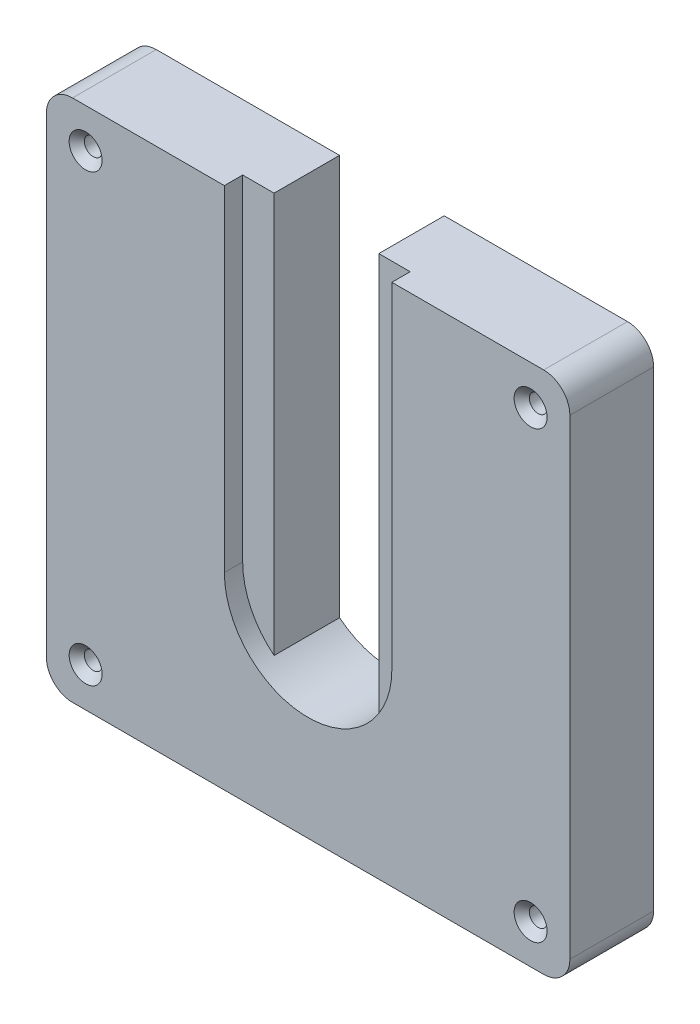
from build123d import *

# Parameters (mm, degrees)
SKETCH1_W                                    = 100
SKETCH1_H                                    = 100
BOSS_EXTRUDE1_DEPTH                          = 16
SKETCH2_W                                    = 100
SKETCH2_H                                    = 100
BOSS_EXTRUDE2_DEPTH                          = 16
CUT_EXTRUDE1_DEPTH                           = 80
BOSS_EXTRUDE3_DEPTH                          = 16
BOSS_EXTRUDE4_REACH                          = 75.763
CSK_FOR_M3_COUNTERSUNK_FLAT_HEAD_SCR_2_COUNT = 2
CSK_FOR_M3_COUNTERSUNK_FLAT_HEAD_SCR_2_PITCH = 85
CSK_FOR_M3_COUNTERSUNK_FLAT_HEAD_SCR_3_COUNT = 2
CSK_FOR_M3_COUNTERSUNK_FLAT_HEAD_SCR_3_PITCH = 120.208152802
CSK_FOR_M3_COUNTERSUNK_FLAT_HEAD_SCR_4_COUNT = 2
CSK_FOR_M3_COUNTERSUNK_FLAT_HEAD_SCR_4_PITCH = 85
FILLET1_R                                    = 5
FILLET2_R                                    = 5


with BuildPart() as part:
    # Sketch1 → Boss-Extrude1 (new body)
    with BuildSketch(Plane.XY):
        Rectangle(SKETCH1_W, SKETCH1_H)
    extrude(amount=BOSS_EXTRUDE1_DEPTH)


with BuildPart() as body_2:
    # Sketch2 → Boss-Extrude2 (new body)
    with BuildSketch(Plane.XY.offset(16)):
        Rectangle(SKETCH2_W, SKETCH2_H)
    extrude(amount=BOSS_EXTRUDE2_DEPTH)


with BuildPart() as cut_extrude1_tool:
    # Sketch3 → Cut-Extrude1 (new body)
    with BuildSketch(Plane(origin=(0, 50, 0), x_dir=(1, 0, 0), z_dir=(0, 1, 0))):
        Polygon((-16, -32), (-16, -28.5), (-10, -28.5), (-10, -16), (-16, -16), (-16, -11), (16, -11), (16, -16), (10, -16), (10, -28.5), (16, -28.5), (16, -32), align=None)
    extrude(amount=-CUT_EXTRUDE1_DEPTH)


with BuildPart() as part_1:
    add(part.part)

    # Cut-Extrude1: cut by cut_extrude1_tool
    add(cut_extrude1_tool.part, mode=Mode.SUBTRACT)



with BuildPart() as body_2_1:
    add(body_2.part)

    # Cut-Extrude1: cut by cut_extrude1_tool
    add(cut_extrude1_tool.part, mode=Mode.SUBTRACT)

    # Sketch4 → Boss-Extrude3 (add)
    with BuildSketch(Plane.XY.offset(32)):
        with BuildLine():
            Line((-16, -14), (-16, -30))
            Line((-16, -30), (0, -30))
            ThreePointArc((0, -30), (-11.313708499, -25.313708499), (-16, -14))
        make_face()
        with BuildLine():
            ThreePointArc((16, -14), (11.313708499, -25.313708499), (0, -30))
            Line((0, -30), (16, -30))
            Line((16, -30), (16, -14))
        make_face()
    extrude(amount=-BOSS_EXTRUDE3_DEPTH)


with BuildPart() as part_2:
    add(part_1.part)

    # Sketch5 → Boss-Extrude4 (add, up to next)
    with BuildSketch(Plane.XY.offset(11), mode=Mode.PRIVATE) as boss_extrude4_sk1:
        with BuildLine():
            Line((16, -30), (16, -14))
            ThreePointArc((16, -14), (11.313708487, -25.313708511), (-3.4e-08, -30))
            Line((-3.4e-08, -30), (16, -30))
        make_face()
    boss_extrude4_tool1 = extrude(boss_extrude4_sk1.sketch, amount=BOSS_EXTRUDE4_REACH, mode=Mode.PRIVATE) - body_2_1.part
    # Sketch5 → Boss-Extrude4 (add, up to next)
    with BuildSketch(Plane.XY.offset(11), mode=Mode.PRIVATE) as boss_extrude4_sk2:
        with BuildLine():
            ThreePointArc((-3.4e-08, -30), (-11.313708511, -25.313708487), (-16, -14))
            Line((-16, -14), (-16, -30))
            Line((-16, -30), (-3.4e-08, -30))
        make_face()
    boss_extrude4_tool2 = extrude(boss_extrude4_sk2.sketch, amount=BOSS_EXTRUDE4_REACH, mode=Mode.PRIVATE) - body_2_1.part
    add(boss_extrude4_tool1.solids().sort_by_distance((12.426113, -26.426113, 11))[0])
    add(boss_extrude4_tool2.solids().sort_by_distance((-12.426113, -26.426113, 11))[0])


with BuildPart() as csk_for_m3_countersunk_flat_head_screw1_tool:
    # Sketch7 → CSK for M3 Countersunk Flat Head Screw1 (revolve)
    with BuildSketch(Plane(origin=(-42.5, 42.5, 32), x_dir=(0, -1, 0), z_dir=(1, 0, 0))):
        Polygon((0, 0), (0, 32), (1.7, 32), (1.7, 1.45), (3.15, 0), align=None)
    csk_for_m3_countersunk_flat_head_screw1 = revolve(axis=Axis((-42.5, 42.5, 38.35), (0, 0, -1)))


with BuildPart() as part_3:
    add(part_2.part)

    # CSK for M3 Countersunk Flat Head Screw1: cut by csk_for_m3_countersunk_flat_head_screw1_tool
    add(csk_for_m3_countersunk_flat_head_screw1_tool.part, mode=Mode.SUBTRACT)


with BuildPart() as body_2_2:
    add(body_2_1.part)

    # CSK for M3 Countersunk Flat Head Screw1: cut by csk_for_m3_countersunk_flat_head_screw1_tool
    add(csk_for_m3_countersunk_flat_head_screw1_tool.part, mode=Mode.SUBTRACT)


with BuildPart() as csk_for_m3_countersunk_flat_head_scr_2_tool:
    # CSK for M3 Countersunk Flat Head Scr 2: CSK for M3 Countersunk Flat Head Screw1 ×2
    with Locations(*[(i * CSK_FOR_M3_COUNTERSUNK_FLAT_HEAD_SCR_2_PITCH, 0, 0) for i in range(1, CSK_FOR_M3_COUNTERSUNK_FLAT_HEAD_SCR_2_COUNT)]):
        add(csk_for_m3_countersunk_flat_head_screw1)


with BuildPart() as part_4:
    add(part_3.part)

    # CSK for M3 Countersunk Flat Head Scr 2: cut by csk_for_m3_countersunk_flat_head_scr_2_tool
    add(csk_for_m3_countersunk_flat_head_scr_2_tool.part, mode=Mode.SUBTRACT)


with BuildPart() as body_2_3:
    add(body_2_2.part)

    # CSK for M3 Countersunk Flat Head Scr 2: cut by csk_for_m3_countersunk_flat_head_scr_2_tool
    add(csk_for_m3_countersunk_flat_head_scr_2_tool.part, mode=Mode.SUBTRACT)


with BuildPart() as csk_for_m3_countersunk_flat_head_scr_3_tool:
    # CSK for M3 Countersunk Flat Head Scr 3: CSK for M3 Countersunk Flat Head Screw1 ×2
    with Locations(*[Vector(0.7071067811865476, -0.7071067811865476, 0) * (i * CSK_FOR_M3_COUNTERSUNK_FLAT_HEAD_SCR_3_PITCH) for i in range(1, CSK_FOR_M3_COUNTERSUNK_FLAT_HEAD_SCR_3_COUNT)]):
        add(csk_for_m3_countersunk_flat_head_screw1)


with BuildPart() as part_5:
    add(part_4.part)

    # CSK for M3 Countersunk Flat Head Scr 3: cut by csk_for_m3_countersunk_flat_head_scr_3_tool
    add(csk_for_m3_countersunk_flat_head_scr_3_tool.part, mode=Mode.SUBTRACT)


with BuildPart() as body_2_4:
    add(body_2_3.part)

    # CSK for M3 Countersunk Flat Head Scr 3: cut by csk_for_m3_countersunk_flat_head_scr_3_tool
    add(csk_for_m3_countersunk_flat_head_scr_3_tool.part, mode=Mode.SUBTRACT)


with BuildPart() as csk_for_m3_countersunk_flat_head_scr_4_tool:
    # CSK for M3 Countersunk Flat Head Scr 4: CSK for M3 Countersunk Flat Head Screw1 ×2
    with Locations(*[(0, -i * CSK_FOR_M3_COUNTERSUNK_FLAT_HEAD_SCR_4_PITCH, 0) for i in range(1, CSK_FOR_M3_COUNTERSUNK_FLAT_HEAD_SCR_4_COUNT)]):
        add(csk_for_m3_countersunk_flat_head_screw1)


with BuildPart() as part_6:
    add(part_5.part)

    # CSK for M3 Countersunk Flat Head Scr 4: cut by csk_for_m3_countersunk_flat_head_scr_4_tool
    add(csk_for_m3_countersunk_flat_head_scr_4_tool.part, mode=Mode.SUBTRACT)

    # Fillet2
    fillet2_edges = [part_6.edges().sort_by_distance(p)[0] for p in [
        (-50, -50, 8),
        (-50, 50, 8),
        (50, 50, 8),
        (50, -50, 8),
    ]]
    fillet(fillet2_edges, radius=FILLET2_R)


with BuildPart() as body_2_5:
    add(body_2_4.part)

    # CSK for M3 Countersunk Flat Head Scr 4: cut by csk_for_m3_countersunk_flat_head_scr_4_tool
    add(csk_for_m3_countersunk_flat_head_scr_4_tool.part, mode=Mode.SUBTRACT)

    # Fillet1
    fillet1_edges = [body_2_5.edges().sort_by_distance(p)[0] for p in [
        (-50, 50, 24),
        (50, 50, 24),
        (50, -50, 24),
        (-50, -50, 24),
    ]]
    fillet(fillet1_edges, radius=FILLET1_R)


solid = body_2_5.part
